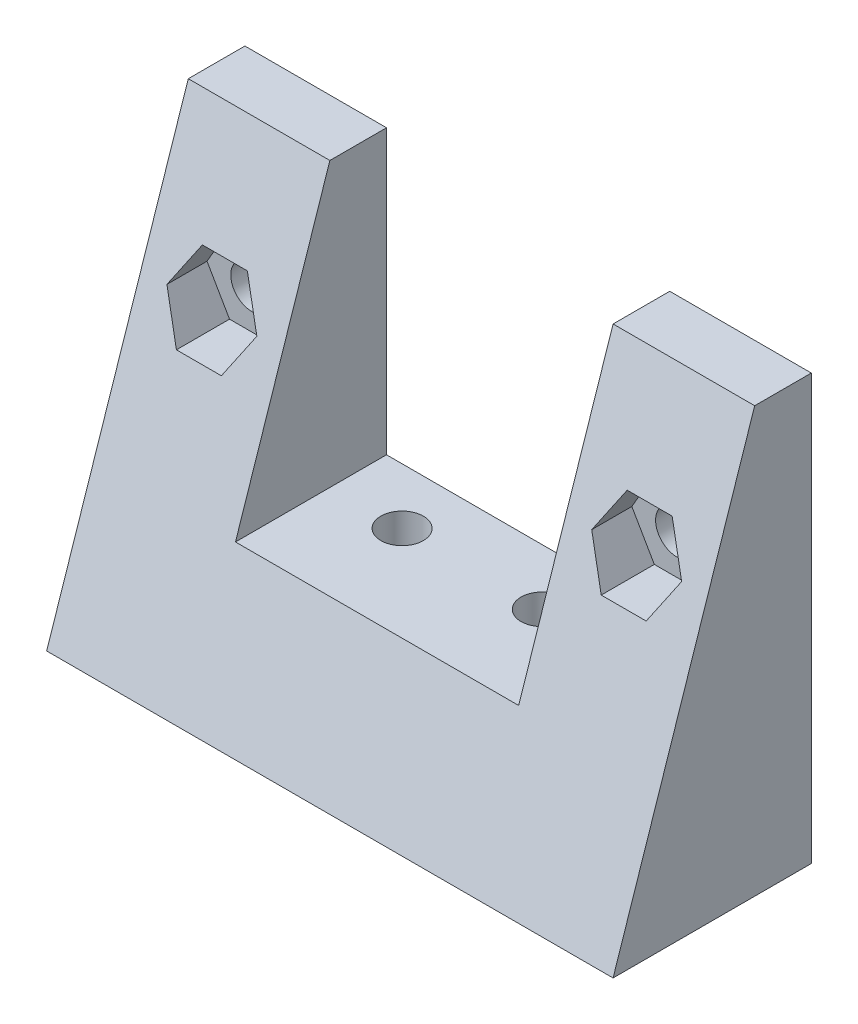
from build123d import *

# Parameters (mm, degrees)
EXTRUDE1_DEPTH = 40
SKETCH2_W      = 20
SKETCH2_H      = 20
EXTRUDE2_DEPTH = 52.923019943
SKETCH3_R      = 1.5
EXTRUDE3_DEPTH = 52.923019943
SKETCH4_R      = 1.5
EXTRUDE4_DEPTH = 47.861498055
EXTRUDE5_DEPTH = 9.5


with BuildPart() as part:
    # Sketch1 → Extrude1 (new body)
    with BuildSketch(Plane(origin=(0, 0, 0), x_dir=(0, 0, -1), z_dir=(1, 0, 0))):
        Polygon((0, 0), (-14, 0), (-4, 30), (0, 30), align=None)
    extrude(amount=-EXTRUDE1_DEPTH)

    # Sketch2 → Extrude2 (cut, through all)
    with BuildSketch(Plane(origin=(0, 0, 0), x_dir=(-1, 0, 0), z_dir=(0, 0, -1))):
        with Locations((20, 20)):
            Rectangle(SKETCH2_W, SKETCH2_H)
    extrude(amount=-EXTRUDE2_DEPTH, mode=Mode.SUBTRACT)

    # Sketch3 → Extrude3 (cut, through all)
    with BuildSketch(Plane(origin=(0, 0, 0), x_dir=(-1, 0, 0), z_dir=(0, 0, -1))):
        with Locations(Location((5, 20, 0), (0, 0, 90))):
            Circle(SKETCH3_R)
        with Locations(Location((35, 20, 0), (0, 0, 90))):
            Circle(SKETCH3_R)
    extrude(amount=-EXTRUDE3_DEPTH, mode=Mode.SUBTRACT)

    # Sketch4 → Extrude4 (cut, through all)
    with BuildSketch(Plane(origin=(0, 10, 0), x_dir=(1, 0, 0), z_dir=(0, 1, 0))):
        with Locations(Location((-24.95, -3.95, 0), (0, 0, 270))):
            Circle(SKETCH4_R)
        with Locations(Location((-15.05, -3.95, 0), (0, 0, 90))):
            Circle(SKETCH4_R)
    extrude(amount=-EXTRUDE4_DEPTH, mode=Mode.SUBTRACT)

    # Sketch8 → Extrude5 (cut)
    with BuildSketch(Plane(origin=(0, 0, 14), x_dir=(-1, 0, 0), z_dir=(0, 0, -1))):
        Polygon((6.58771324, 17.25), (8.175426481, 20), (6.58771324, 22.75), (3.41228676, 22.75), (1.824573519, 20), (3.41228676, 17.25), align=None)
        Polygon((36.58771324, 17.25), (33.41228676, 17.25), (31.824573519, 20), (33.41228676, 22.75), (36.58771324, 22.75), (38.175426481, 20), align=None)
    extrude(amount=EXTRUDE5_DEPTH, mode=Mode.SUBTRACT)


solid = part.part
